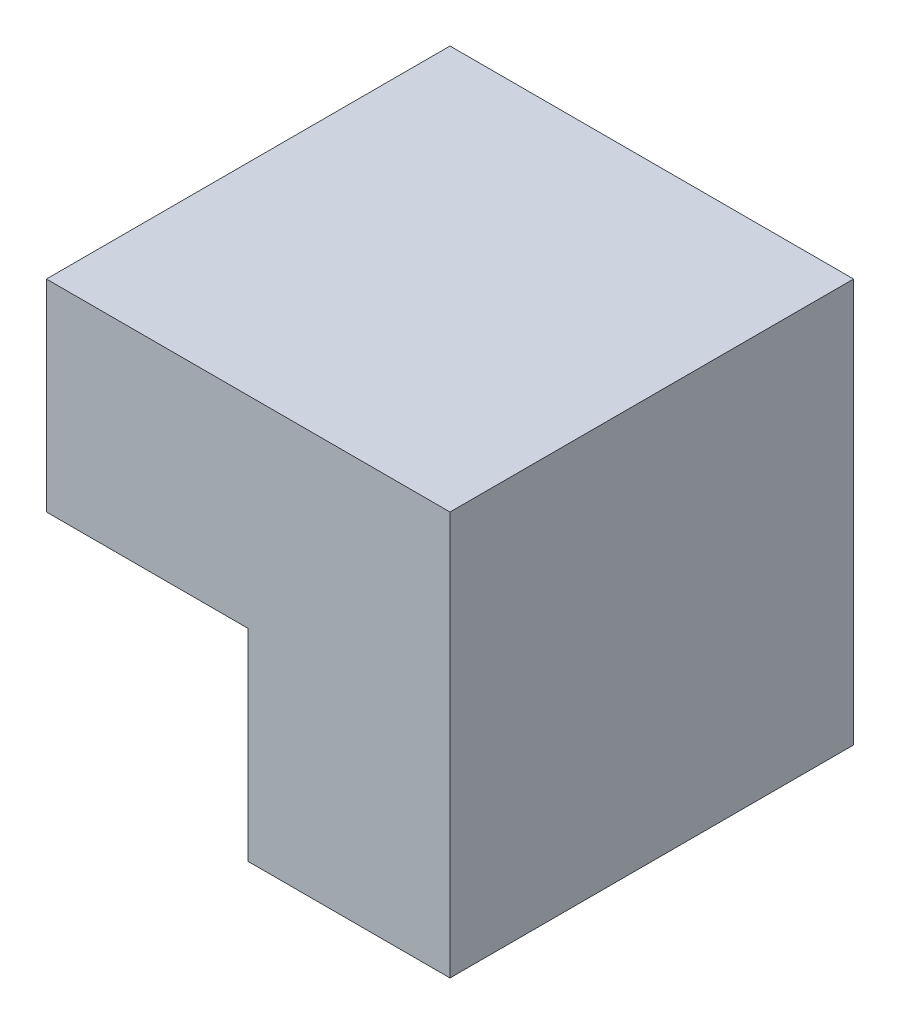
from build123d import *

# Parameters (mm, degrees)
SELECTIONEXTRUDE_DEPTH = 10


with BuildPart() as part:
    # SelectionSeed → SelectionExtrude (new body)
    with BuildSketch(Plane.XY):
        Polygon((10, 10), (10, 5), (15, 5), (15, 15), (5, 15), (5, 10), align=None)
    extrude(amount=SELECTIONEXTRUDE_DEPTH)


solid = part.part
